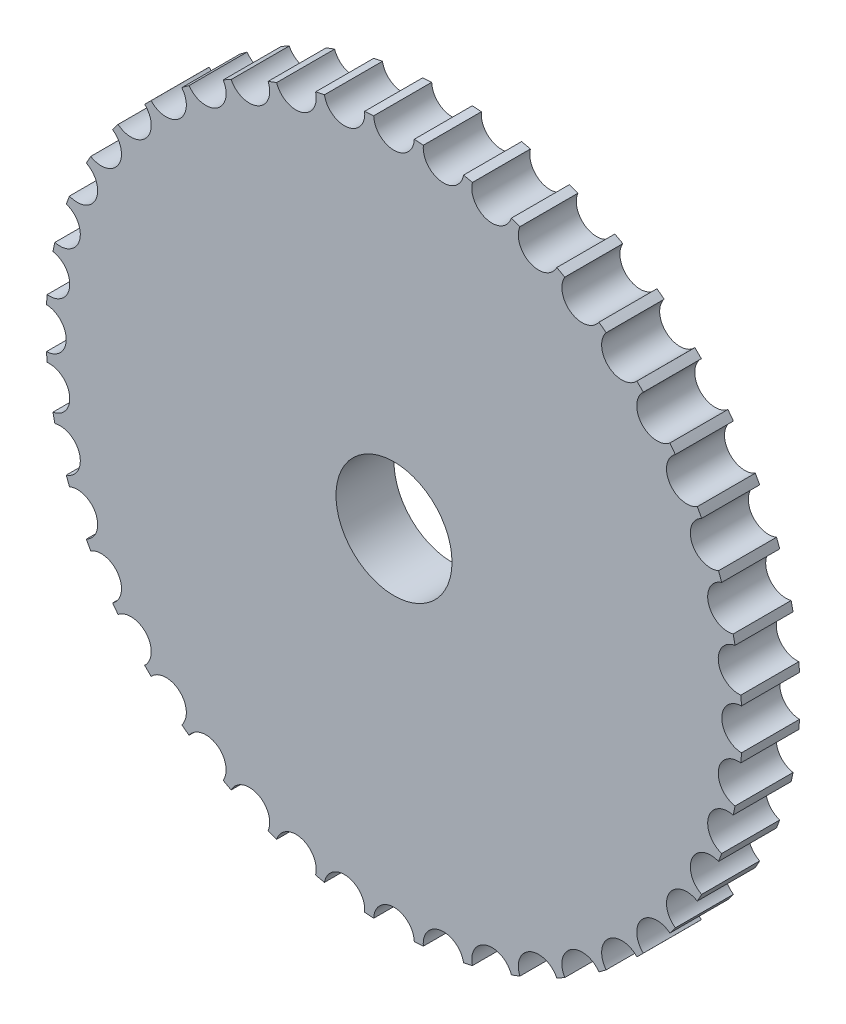
from build123d import *

# Parameters (mm, degrees)
SKETCH1_R           = 76.2
SKETCH1_R_2         = 12.7
BOSS_EXTRUDE1_DEPTH = 12.7
SKETCH2_R           = 4.445
CUT_EXTRUDE1_DEPTH  = 109.508847566
CIRPATTERN1_COUNT   = 44


with BuildPart() as part:
    # Sketch1 → Boss-Extrude1 (new body)
    with BuildSketch(Plane.XY):
        Circle(SKETCH1_R)
        Circle(SKETCH1_R_2, mode=Mode.SUBTRACT)
    extrude(amount=BOSS_EXTRUDE1_DEPTH)

    # Sketch2 → Cut-Extrude1 (cut, through all)
    with BuildSketch(Plane.XY.offset(12.7)):
        with Locations((0, 76.2)):
            Circle(SKETCH2_R)
    cut_extrude1 = extrude(amount=-CUT_EXTRUDE1_DEPTH, mode=Mode.SUBTRACT)

    # CirPattern1: Cut-Extrude1 ×44 about axis
    cirpattern1_axis = Axis((0, 0, 0), (0, 0, 1))
    for i in range(1, CIRPATTERN1_COUNT):
        add(cut_extrude1.rotate(cirpattern1_axis, i * 360 / CIRPATTERN1_COUNT), mode=Mode.SUBTRACT)


solid = part.part
